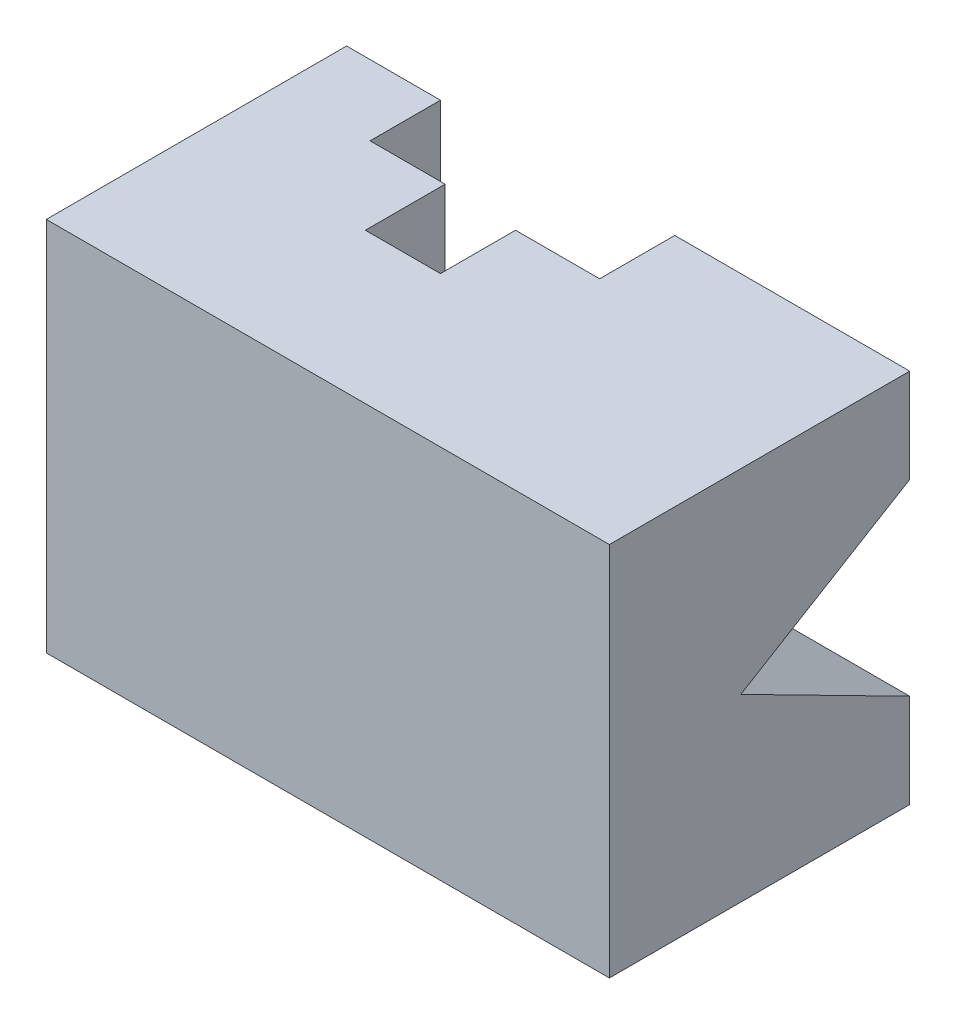
from build123d import *

# Parameters (mm, degrees)
BOSS_EXTRUDE1_DEPTH = 100
CUT_EXTRUDE1_DEPTH  = 50


with BuildPart() as part:
    # Sketch1 → Boss-Extrude1 (new body)
    with BuildSketch(Plane(origin=(0, 0, 0), x_dir=(1, 0, 0), z_dir=(0, 1, 0))):
        Polygon((-105.576923077, -23.605769231), (44.423076923, -23.605769231), (44.423076923, 56.394230769), (-18.173076923, 56.394230769), (-18.173076923, 36.394230769), (-40.576923077, 36.394230769), (-40.576923077, 16.394230769), (-60.576923077, 16.394230769), (-60.576923077, 37.644230769), (-80.576923077, 37.644230769), (-80.576923077, 56.394230769), (-105.576923077, 56.394230769), align=None)
    extrude(amount=-BOSS_EXTRUDE1_DEPTH)

    # Sketch3 → Cut-Extrude1 (cut)
    with BuildSketch(Plane(origin=(44.423076923, 0, 0), x_dir=(0, 0, -1), z_dir=(1, 0, 0))):
        Polygon((56.394230769, -25), (11.394230769, -52.073671681), (56.394230769, -75), align=None)
    extrude(amount=-CUT_EXTRUDE1_DEPTH, mode=Mode.SUBTRACT)


solid = part.part
